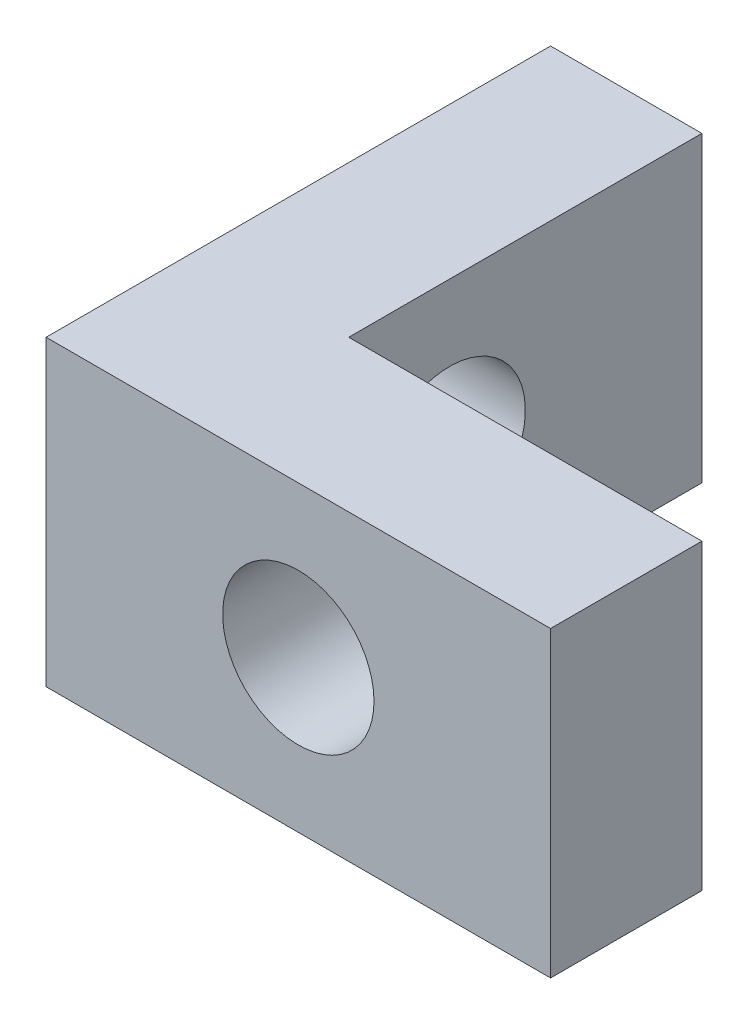
from build123d import *

# Parameters (mm, degrees)
EXTRUDE_1_DEPTH     = 6
SKETCH_2_R          = 1.5
CUT_EXTRUDE_1_DEPTH = 6
SKETCH_3_R          = 1.5
CUT_EXTRUDE_2_DEPTH = 6


with BuildPart() as part:
    # 草图1 → 凸台-拉伸1 (new body)
    with BuildSketch(Plane(origin=(0, 0, 0), x_dir=(1, 0, 0), z_dir=(0, 1, 0))):
        Polygon((0, 0), (10, 0), (10, 3), (3, 3), (3, 10), (0, 10), align=None)
    extrude(amount=EXTRUDE_1_DEPTH)

    # 草图2 → 切除-拉伸1 (cut)
    with BuildSketch(Plane.XY):
        with Locations((5, 3)):
            Circle(SKETCH_2_R)
    extrude(amount=-CUT_EXTRUDE_1_DEPTH, mode=Mode.SUBTRACT)

    # 草图3 → 切除-拉伸2 (cut)
    with BuildSketch(Plane.ZY):
        with Locations((-5, 3)):
            Circle(SKETCH_3_R)
    extrude(amount=-CUT_EXTRUDE_2_DEPTH, mode=Mode.SUBTRACT)


solid = part.part
